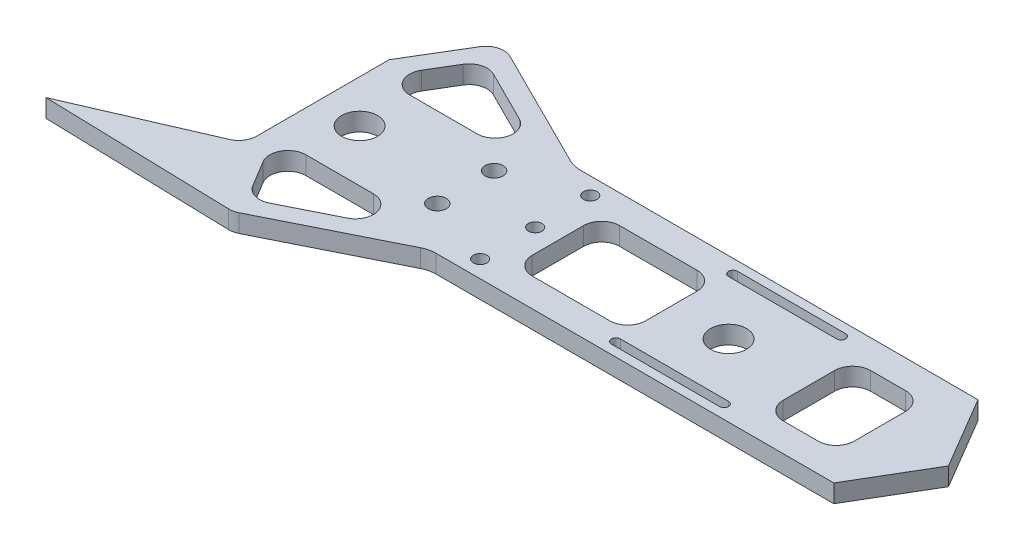
from build123d import *

# Parameters (mm, degrees)
CROQUIS1_R              = 6.35
SALIENTE_EXTRUIR1_DEPTH = 6.35
CORTAR_EXTRUIR2_DEPTH   = 225.270156497
CORTAR_EXTRUIR3_DEPTH   = 225.270156497
REDONDEO1_R             = 10
CROQUIS8_R              = 2.38125
CORTAR_EXTRUIR4_DEPTH   = 225.270156497
REDONDEO2_R             = 6.35
CROQUIS10_R             = 3.175
CORTAR_EXTRUIR6_DEPTH   = 225.270156497


with BuildPart() as part:
    # Croquis1 → Saliente-Extruir1 (new body)
    with BuildSketch(Plane(origin=(0, 0, 0), x_dir=(1, 0, 0), z_dir=(0, 1, 0))):
        with BuildLine():
            Line((37.5, -25.4), (52.5, 0))
            Line((52.5, 0), (37.5, 25.4))
            Line((37.5, 25.4), (-105, 25.4))
            Line((-105, 25.4), (-149.746813481, 47.731727951))
            ThreePointArc((-149.746813481, 47.731727951), (-154.357530471, 48.146831931), (-158.024774803, 45.321528145))
            Line((-158.024774803, 45.321528145), (-170, 25.4))
            Line((-170, 25.4), (-170, -25.4))
            Line((-170, -25.4), (-218.893171651, -46.613192851))
            Line((-218.893171651, -46.613192851), (-152.75365104, -48.397689977))
            ThreePointArc((-152.75365104, -48.397689977), (-151.209247261, -48.24975741), (-149.746813481, -47.731727951))
            Line((-149.746813481, -47.731727951), (-105, -25.4))
            Line((-105, -25.4), (37.5, -25.4))
        make_face()
        with Locations(Location((-155, 0, 0), (0, 0, 270))):
            Circle(CROQUIS1_R, mode=Mode.SUBTRACT)
        with Locations(Location((-25, 0, 0), (0, 0, 270))):
            Circle(CROQUIS1_R, mode=Mode.SUBTRACT)
        with BuildLine():
            Line((-129.045100716, 30.303281185), (-147.329198773, 39.428299747))
            ThreePointArc((-147.329198773, 39.428299747), (-151.939915763, 39.843403727), (-155.607160095, 37.018099941))
            Line((-155.607160095, 37.018099941), (-161.092389512, 27.893081378))
            ThreePointArc((-161.092389512, 27.893081378), (-161.177056347, 21.495189828), (-155.65, 18.271553233))
            Line((-155.65, 18.271553233), (-131.880672526, 18.271553233))
            ThreePointArc((-131.880672526, 18.271553233), (-125.699998109, 23.164925706), (-129.045100716, 30.303281185))
        make_face(mode=Mode.SUBTRACT)
        with BuildLine():
            Line((-129.045100716, -30.303281185), (-147.329198773, -39.428299747))
            ThreePointArc((-147.329198773, -39.428299747), (-151.939915763, -39.843403727), (-155.607160095, -37.018099941))
            Line((-155.607160095, -37.018099941), (-161.092389512, -27.893081378))
            ThreePointArc((-161.092389512, -27.893081378), (-161.177056347, -21.495189828), (-155.65, -18.271553233))
            Line((-155.65, -18.271553233), (-131.880672526, -18.271553233))
            ThreePointArc((-131.880672526, -18.271553233), (-125.699998109, -23.164925706), (-129.045100716, -30.303281185))
        make_face(mode=Mode.SUBTRACT)
    extrude(amount=SALIENTE_EXTRUIR1_DEPTH)

    # Croquis5 → Cortar-Extruir2 (cut, through all)
    with BuildSketch(Plane(origin=(0, 6.35, 0), x_dir=(1, 0, 0), z_dir=(0, 1, 0))):
        with BuildLine():
            Line((-44.05, 22.225), (-5.95, 22.225))
            ThreePointArc((-5.95, 22.225), (-4.3625, 20.6375), (-5.95, 19.05))
            Line((-5.95, 19.05), (-44.05, 19.05))
            ThreePointArc((-44.05, 19.05), (-45.6375, 20.6375), (-44.05, 22.225))
        make_face()
        with BuildLine():
            Line((-5.95, -19.05), (-44.05, -19.05))
            ThreePointArc((-44.05, -19.05), (-45.6375, -20.6375), (-44.05, -22.225))
            Line((-44.05, -22.225), (-5.95, -22.225))
            ThreePointArc((-5.95, -22.225), (-4.3625, -20.6375), (-5.95, -19.05))
        make_face()
    extrude(amount=-CORTAR_EXTRUIR2_DEPTH, mode=Mode.SUBTRACT)

    # Croquis7 → Cortar-Extruir3 (cut, through all)
    with BuildSketch(Plane(origin=(0, 6.35, 0), x_dir=(1, 0, 0), z_dir=(0, 1, 0))):
        with BuildLine():
            Line((-78.775, 15.4), (-51.475, 15.4))
            ThreePointArc((-51.475, 15.4), (-46.984871939, 13.540128061), (-45.125, 9.05))
            Line((-45.125, 9.05), (-45.125, -9.05))
            ThreePointArc((-45.125, -9.05), (-46.984871939, -13.540128061), (-51.475, -15.4))
            Line((-51.475, -15.4), (-78.775, -15.4))
            ThreePointArc((-78.775, -15.4), (-83.265128061, -13.540128061), (-85.125, -9.05))
            Line((-85.125, -9.05), (-85.125, 9.05))
            ThreePointArc((-85.125, 9.05), (-83.265128061, 13.540128061), (-78.775, 15.4))
        make_face()
        with BuildLine():
            Line((9.675, 15.4), (21.975, 15.4))
            ThreePointArc((21.975, 15.4), (26.465128061, 13.540128061), (28.325, 9.05))
            Line((28.325, 9.05), (28.325, -9.05))
            ThreePointArc((28.325, -9.05), (26.465128061, -13.540128061), (21.975, -15.4))
            Line((21.975, -15.4), (9.675, -15.4))
            ThreePointArc((9.675, -15.4), (5.184871939, -13.540128061), (3.325, -9.05))
            Line((3.325, -9.05), (3.325, 9.05))
            ThreePointArc((3.325, 9.05), (5.184871939, 13.540128061), (9.675, 15.4))
        make_face()
    extrude(amount=-CORTAR_EXTRUIR3_DEPTH, mode=Mode.SUBTRACT)

    # Redondeo1
    redondeo1_edges = [part.edges().sort_by_distance(p)[0] for p in [
        (-105, 3.175, 25.4),
        (-105, 3.175, -25.4),
    ]]
    fillet(redondeo1_edges, radius=REDONDEO1_R)

    # Croquis8 → Cortar-Extruir4 (cut, through all)
    with BuildSketch(Plane(origin=(0, 6.35, 0), x_dir=(1, 0, 0), z_dir=(0, 1, 0))):
        with Locations(Location((-93.125, 0, 0), (0, 0, 270))):
            Circle(CROQUIS8_R)
        with Locations(Location((-93.125, 19.4, 0), (0, 0, 270))):
            Circle(CROQUIS8_R)
        with Locations(Location((-93.125, -19.4, 0), (0, 0, 270))):
            Circle(CROQUIS8_R)
    extrude(amount=-CORTAR_EXTRUIR4_DEPTH, mode=Mode.SUBTRACT)

    # Redondeo2
    redondeo2_edges = [part.edges().sort_by_distance(p)[0] for p in [
        (-170, 3.175, 25.4),
    ]]
    fillet(redondeo2_edges, radius=REDONDEO2_R)

    # Croquis10 → Cortar-Extruir6 (cut, through all)
    with BuildSketch(Plane(origin=(0, 6.35, 0), x_dir=(1, 0, 0), z_dir=(0, 1, 0))):
        with Locations(Location((-117.61165924, -10, 0), (0, 0, 270))):
            Circle(CROQUIS10_R)
        with Locations(Location((-117.61165924, 10, 0), (0, 0, 270))):
            Circle(CROQUIS10_R)
    extrude(amount=-CORTAR_EXTRUIR6_DEPTH, mode=Mode.SUBTRACT)


solid = part.part
